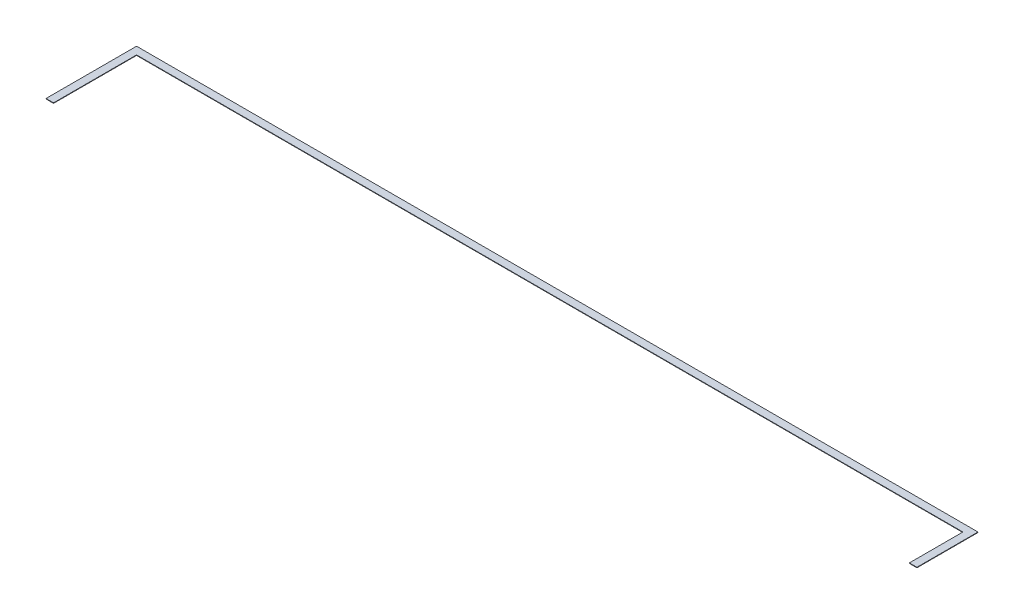
from build123d import *

# Parameters (mm, degrees)
BOSS_EXTRUDE1_DEPTH = 3.175


with BuildPart() as part:
    # Sketch1 → Boss-Extrude1 (new body)
    with BuildSketch(Plane(origin=(0, 0, 0), x_dir=(1, 0, 0), z_dir=(0, 1, 0))):
        Polygon((0, 609.6), (5664.2, 609.6), (5664.2, 198.4375), (5613.4, 198.4375), (5613.4, 558.8), (50.8, 558.8), (50.8, 0), (0, 0), align=None)
    extrude(amount=BOSS_EXTRUDE1_DEPTH)


solid = part.part
